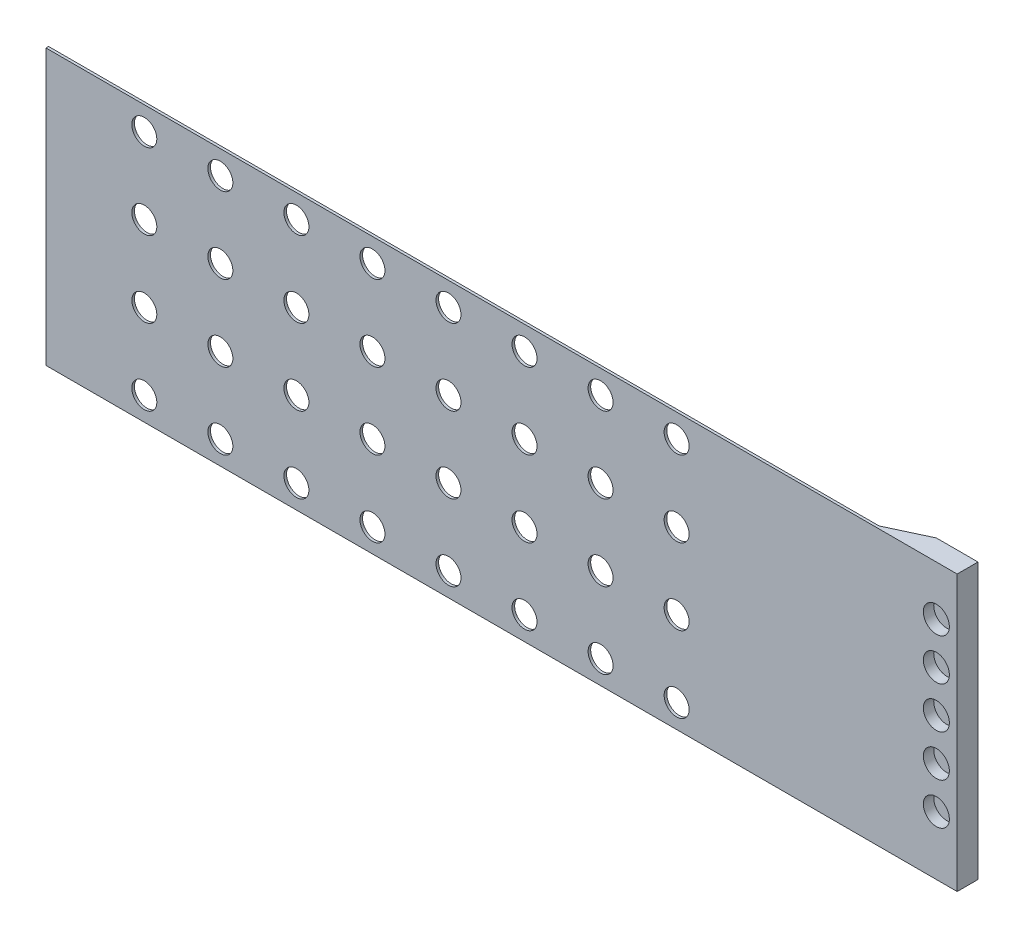
from build123d import *

# Parameters (mm, degrees)
SKETCH1_W               = 250
SKETCH1_H               = 100
BOSS_EXTRUDE1_DEPTH     = 0.25
SKETCH2_R               = 2.4
CUT_EXTRUDE1_DEPTH      = 135.630048652
SKETCH3_W               = 375
SKETCH3_H               = 252.815
SKETCH3_W_2             = 175
SKETCH3_H_2             = 52.815
CUT_EXTRUDE_THIN1_DEPTH = 135.630048652
SKETCH6_W               = 8
SKETCH6_H               = 52.815
BOSS_EXTRUDE3_DEPTH     = 3.5
CUT_EXTRUDE2_DEPTH      = 109.564681181
CUT_EXTRUDE2_DEPTH_BACK = 2
SKETCH5_R               = 2.5
BOSS_EXTRUDE4_DEPTH     = 52.815


with BuildPart() as part:
    # Sketch1 → Boss-Extrude1 (new, symmetric)
    with BuildSketch(Plane.XY):
        Rectangle(SKETCH1_W, SKETCH1_H)
    extrude(amount=BOSS_EXTRUDE1_DEPTH, both=True)

    # Sketch2 → Cut-Extrude1 (cut, through all)
    with BuildSketch(Plane.XY.offset(0.25)):
        with Locations((-51.1175, -22.8)):
            Circle(SKETCH2_R)
        with Locations((-36.5125, -22.8)):
            Circle(SKETCH2_R)
        with Locations((-21.9075, -22.8)):
            Circle(SKETCH2_R)
        with Locations((-7.3025, -22.8)):
            Circle(SKETCH2_R)
        with Locations((7.3025, -22.8)):
            Circle(SKETCH2_R)
        with Locations((21.9075, -22.8)):
            Circle(SKETCH2_R)
        with Locations((36.5125, -22.8)):
            Circle(SKETCH2_R)
        with Locations((51.1175, -22.8)):
            Circle(SKETCH2_R)
        with Locations((-36.5125, -8.195)):
            Circle(SKETCH2_R)
        with Locations((-21.9075, -8.195)):
            Circle(SKETCH2_R)
        with Locations((-7.3025, -8.195)):
            Circle(SKETCH2_R)
        with Locations((7.3025, -8.195)):
            Circle(SKETCH2_R)
        with Locations((21.9075, -8.195)):
            Circle(SKETCH2_R)
        with Locations((36.5125, -8.195)):
            Circle(SKETCH2_R)
        with Locations((51.1175, -8.195)):
            Circle(SKETCH2_R)
        with Locations((-36.5125, 6.41)):
            Circle(SKETCH2_R)
        with Locations((-21.9075, 6.41)):
            Circle(SKETCH2_R)
        with Locations((-7.3025, 6.41)):
            Circle(SKETCH2_R)
        with Locations((7.3025, 6.41)):
            Circle(SKETCH2_R)
        with Locations((21.9075, 6.41)):
            Circle(SKETCH2_R)
        with Locations((36.5125, 6.41)):
            Circle(SKETCH2_R)
        with Locations((51.1175, 6.41)):
            Circle(SKETCH2_R)
        with Locations((-36.5125, 21.015)):
            Circle(SKETCH2_R)
        with Locations((-21.9075, 21.015)):
            Circle(SKETCH2_R)
        with Locations((-7.3025, 21.015)):
            Circle(SKETCH2_R)
        with Locations((7.3025, 21.015)):
            Circle(SKETCH2_R)
        with Locations((21.9075, 21.015)):
            Circle(SKETCH2_R)
        with Locations((36.5125, 21.015)):
            Circle(SKETCH2_R)
        with Locations((51.1175, 21.015)):
            Circle(SKETCH2_R)
        with Locations((-51.1175, -8.195)):
            Circle(SKETCH2_R)
        with Locations((-51.1175, 6.41)):
            Circle(SKETCH2_R)
        with Locations((-51.1175, 21.015)):
            Circle(SKETCH2_R)
    extrude(amount=-CUT_EXTRUDE1_DEPTH, mode=Mode.SUBTRACT)

    # Sketch3 → Cut-Extrude-Thin1 (cut, through all)
    with BuildSketch(Plane.XY.offset(0.25)):
        with Locations((17.5, -0.8925)):
            Rectangle(SKETCH3_W, SKETCH3_H)
        with Locations((17.5, -0.8925)):
            Rectangle(SKETCH3_W_2, SKETCH3_H_2, mode=Mode.SUBTRACT)
    extrude(amount=-CUT_EXTRUDE_THIN1_DEPTH, mode=Mode.SUBTRACT)

    # Sketch6 → Boss-Extrude3 (add)
    with BuildSketch(Plane(origin=(0, 0, -0.25), x_dir=(-1, 0, 0), z_dir=(0, 0, -1))):
        with Locations((-101, -0.8925)):
            Rectangle(SKETCH6_W, SKETCH6_H)
    extrude(amount=BOSS_EXTRUDE3_DEPTH)

    # Sketch5 → Cut-Extrude2 (cut, two sides: drawn at the far end of the back side and taken through both)
    with BuildSketch(Plane.XY.offset(0.25).offset(-CUT_EXTRUDE2_DEPTH_BACK)):
        with Locations(Location((101, -16, 0), (0, 0, 180))):
            Circle(SKETCH5_R)
        with Locations(Location((101, -8, 0), (0, 0, 180))):
            Circle(SKETCH5_R)
        with Locations(Location((101, 0, 0), (0, 0, 180))):
            Circle(SKETCH5_R)
        with Locations(Location((101, 8, 0), (0, 0, 180))):
            Circle(SKETCH5_R)
        with Locations(Location((101, 16, 0), (0, 0, 180))):
            Circle(SKETCH5_R)
    extrude(amount=CUT_EXTRUDE2_DEPTH + CUT_EXTRUDE2_DEPTH_BACK, mode=Mode.SUBTRACT)

    # Sketch8 → Boss-Extrude4 (add, through all)
    with BuildSketch(Plane(origin=(0, 25.515, 0), x_dir=(1, 0, 0), z_dir=(0, 1, 0))):
        Polygon((89.5, 0.25), (97, 3.75), (97, 0.25), align=None)
    extrude(amount=-BOSS_EXTRUDE4_DEPTH)


solid = part.part
